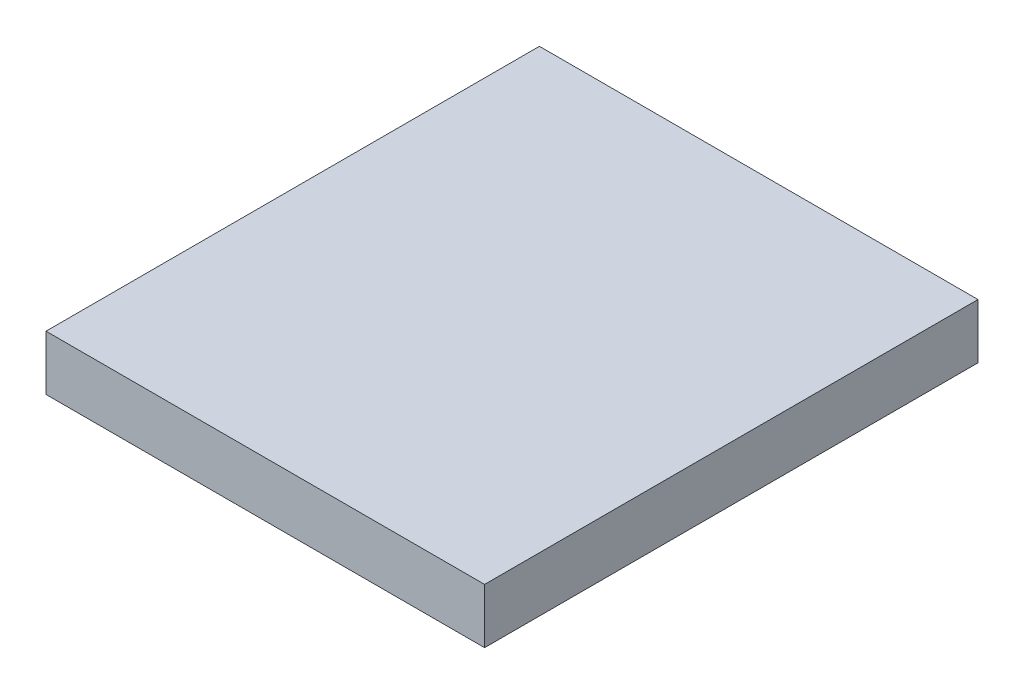
from build123d import *

# Parameters (mm, degrees)
SKETCH1_W           = 203.2
SKETCH1_H           = 228.6
BOSS_EXTRUDE1_DEPTH = 25.4


with BuildPart() as part:
    # Sketch1 → Boss-Extrude1 (new body)
    with BuildSketch(Plane(origin=(0, 0, 0), x_dir=(1, 0, 0), z_dir=(0, 1, 0))):
        Rectangle(SKETCH1_W, SKETCH1_H)
    extrude(amount=BOSS_EXTRUDE1_DEPTH)


solid = part.part
